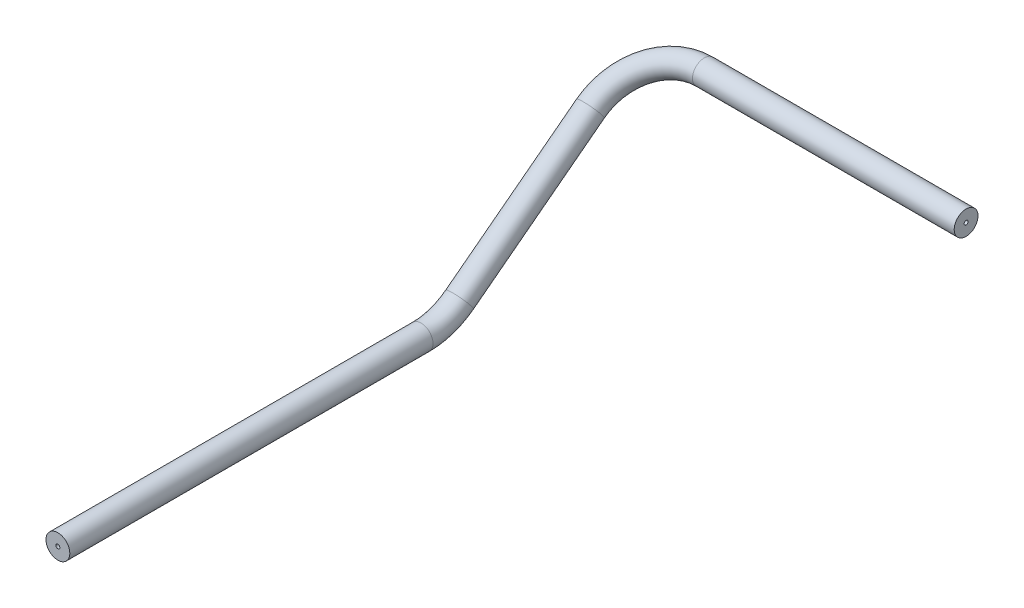
from build123d import *

# Parameters (mm, degrees)
SKICA4_R   = 3
SKICA4_R_2 = 0.5


with BuildPart() as part:
    # Táhnout po křivce1: sweep along a curve in space
    with BuildLine() as t_hnout_po_k_ivce1_path:
        Line((82, 0, 0), (16, 0, 0))
        ThreePointArc((16, 0, 0), (4.686291501, -2.845029331, 3.723860381), (0, -9.713537728, 12.714054617))
        Line((0, -9.713537728, 12.714054617), (0, -34.914054617, 45.699024368))
        ThreePointArc((0, -34.914054617, 45.699024368), (0, -37.35626725, 50.285422244), (0, -38.2, 55.412562096))
        Line((0, -38.2, 55.412562096), (0, -38.2, 147))
    # Skica4 → Táhnout po křivce1 (sweep)
    with BuildSketch(Plane(origin=(82, 0, 0), x_dir=(0, 0, -1), z_dir=(1, 0, 0))):
        Circle(SKICA4_R)
        Circle(SKICA4_R_2, mode=Mode.SUBTRACT)
    sweep(path=t_hnout_po_k_ivce1_path.line)


solid = part.part
